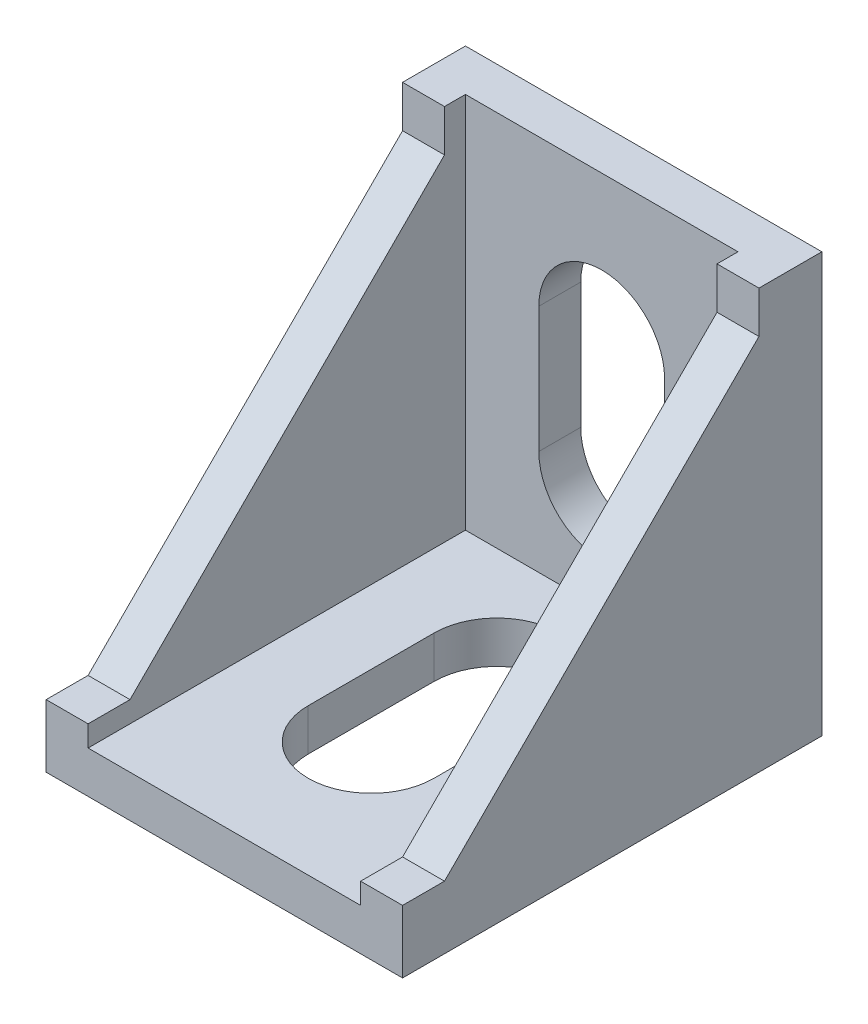
from build123d import *

# Parameters (mm, degrees)
BASE_DEPTH        = 2
SIDES_DEPTH       = 18
NUBS_BOTTOM_DEPTH = 1
NUBS_REAR_DEPTH   = 1
SIDE_CUT_REACH    = 35.615
REAR_SLOT_DEPTH   = 34


with BuildPart() as part:
    # Base Sketch → Base (new body)
    with BuildSketch(Plane(origin=(0, 0, 0), x_dir=(1, 0, 0), z_dir=(0, 1, 0))):
        Polygon((0, 0), (2, 0), (15, 0), (17, 0), (17, 20), (0, 20), align=None)
        with BuildLine():
            Line((5.5, 13), (5.5, 7))
            ThreePointArc((5.5, 7), (8.5, 4), (11.5, 7))
            Line((11.5, 7), (11.5, 13))
            ThreePointArc((11.5, 13), (8.5, 16), (5.5, 13))
        make_face(mode=Mode.SUBTRACT)
    extrude(amount=BASE_DEPTH)

    # MainUprightSketch → Sides (add)
    with BuildSketch(Plane(origin=(0, 2, 0), x_dir=(1, 0, 0), z_dir=(0, 1, 0))):
        Polygon((17, 0), (17, 20), (0, 20), (0, 0), (2, 0), (2, 18), (15, 18), (15, 0), align=None)
    extrude(amount=SIDES_DEPTH)

    # NubsSketch → Nubs-Bottom (add)
    with BuildSketch(Plane(origin=(0, 0, 0), x_dir=(1, 0, 0), z_dir=(0, 1, 0))):
        with BuildLine():
            Line((7, 19), (10, 19))
            ThreePointArc((10, 19), (11, 18), (10, 17))
            Line((10, 17), (7, 17))
            ThreePointArc((7, 17), (6, 18), (7, 19))
        make_face()
        with BuildLine():
            Line((7, 1), (10, 1))
            ThreePointArc((10, 1), (11, 2), (10, 3))
            Line((10, 3), (7, 3))
            ThreePointArc((7, 3), (6, 2), (7, 1))
        make_face()
    extrude(amount=-NUBS_BOTTOM_DEPTH)

    # RearNubsSketch → Nubs-Rear (add)
    with BuildSketch(Plane.XY.offset(-20)):
        with BuildLine():
            Line((10, 3), (7, 3))
            ThreePointArc((7, 3), (6, 2), (7, 1))
            Line((7, 1), (10, 1))
            ThreePointArc((10, 1), (11, 2), (10, 3))
        make_face()
        with BuildLine():
            Line((10, 19), (7, 19))
            ThreePointArc((7, 19), (6, 18), (7, 17))
            Line((7, 17), (10, 17))
            ThreePointArc((10, 17), (11, 18), (10, 19))
        make_face()
    extrude(amount=-NUBS_REAR_DEPTH)

    # Cutaway Sketch → Side Cut (cut, up to next)
    with BuildSketch(Plane(origin=(0, 0, 0), x_dir=(0, 0, -1), z_dir=(1, 0, 0)), mode=Mode.PRIVATE) as side_cut_sk1:
        Polygon((0, 3), (2, 3), (17, 18), (17, 20), (0, 20), align=None)
    side_cut_tool1 = extrude(side_cut_sk1.sketch, amount=SIDE_CUT_REACH, mode=Mode.PRIVATE) & part.part
    add(side_cut_tool1.solids().sort_by_distance((0, 13.730878, -6.269122))[0], mode=Mode.SUBTRACT)
    add(side_cut_tool1.solids().sort_by_distance((0, 13.730878, -6.269122))[1], mode=Mode.SUBTRACT)

    # RearSlotSketch → Rear Slot (cut, through all)
    with BuildSketch(Plane.XY.offset(-20)):
        with BuildLine():
            Line((5.5, 13), (5.5, 7))
            ThreePointArc((5.5, 7), (8.5, 4), (11.5, 7))
            Line((11.5, 7), (11.5, 13))
            ThreePointArc((11.5, 13), (8.5, 16), (5.5, 13))
        make_face()
    extrude(amount=REAR_SLOT_DEPTH, mode=Mode.SUBTRACT)


solid = part.part
